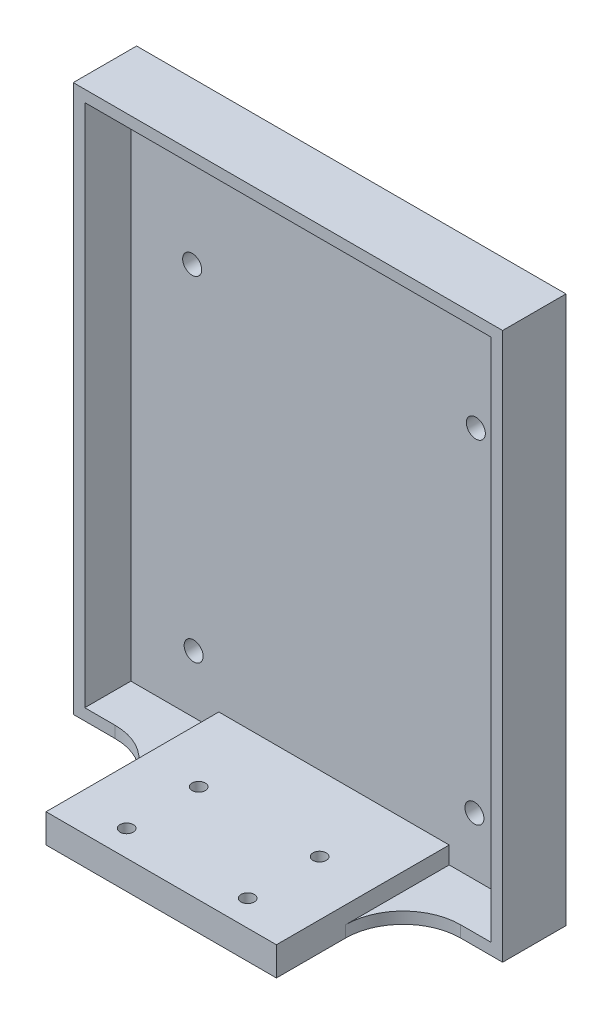
from build123d import *

# Parameters (mm, degrees)
CROQUIS1_W                  = 30
CROQUIS1_H                  = 30
SALIENTE_EXTRUIR1_DEPTH     = 15
CROQUIS6_R                  = 11.175
CORTAR_EXTRUIR1_DEPTH       = 10
CROQUIS11_W                 = 17.25
CROQUIS11_H                 = 40
SALIENTE_EXTRUIR3_DEPTH     = 12
CORTAR_EXTRUIR2_DEPTH       = 220.794464504
CORTAR_EXTRUIR2_DEPTH_BACK  = 220.794464504
CROQUIS9_R                  = 5
CROQUIS14_W                 = 64.5
CROQUIS14_H                 = 82
SALIENTE_EXTRUIR4_DEPTH     = 40
CORTAR_EXTRUIR3_START       = -10
CROQUIS10_R                 = 11.175
CORTAR_EXTRUIR3_DEPTH       = 10
CORTAR_EXTRUIR5_DEPTH       = 230.716361252
CORTAR_EXTRUIR5_DEPTH_BACK  = 10
CROQUIS13_R                 = 11.175
CORTAR_EXTRUIR6_DEPTH       = 183.220714139
CROQUIS16_W                 = 64.5
CROQUIS16_H                 = 82
CROQUIS16_W_2               = 56
CROQUIS16_H_2               = 77
SALIENTE_EXTRUIR5_DEPTH     = 5
CROQUIS17_W                 = 30
CROQUIS17_H                 = 30
CORTAR_EXTRUIR7_DEPTH       = 218.102899858
CROQUIS19_W                 = 18
CROQUIS19_H                 = 4.5
SALIENTE_EXTRUIR6_DEPTH     = 60
CROQUIS22_W                 = 12
CROQUIS22_H                 = 15
CORTAR_EXTRUIR8_DEPTH       = 2
CROQUIS23_W                 = 3.8
CROQUIS23_H                 = 47
SALIENTE_EXTRUIR8_DEPTH     = 19.8
CROQUIS24_R                 = 8.35
CROQUIS24_R_2               = 1
CROQUIS24_W                 = 4.8
CROQUIS24_H                 = 12
CORTAR_EXTRUIR10_DEPTH      = 241.553879883
CROQUIS25_W                 = 3.8
CROQUIS25_H                 = 47
SALIENTE_EXTRUIR9_DEPTH     = 2
REDONDEO2_R                 = 3
CROQUIS26_W                 = 47
CROQUIS26_H                 = 3.8
SALIENTE_EXTRUIR10_DEPTH    = 21.8
REDONDEO3_R                 = 3
CROQUIS28_R                 = 8.35
CROQUIS28_R_2               = 1
CROQUIS28_W                 = 12
CROQUIS28_H                 = 4.8
CORTAR_EXTRUIR11_DEPTH      = 21.8
CORTAR_EXTRUIR12_DEPTH      = 231.964513782
CORTAR_EXTRUIR12_DEPTH_BACK = 231.964513782
CORTAR_EXTRUIR13_DEPTH      = 218.102899858
CORTAR_EXTRUIR13_DEPTH_BACK = 218.102899858
CROQUIS29_R                 = 1.65
CORTAR_EXTRUIR14_DEPTH      = 221.700405815
CORTAR_EXTRUIR14_DEPTH_BACK = 8
CROQUIS32_R                 = 5.15
CROQUIS34_W                 = 22.273731586
CROQUIS34_H                 = 49.346142378
SALIENTE_EXTRUIR11_DEPTH    = 12
CORTAR_EXTRUIR17_DEPTH      = 233.924926242
CORTAR_EXTRUIR17_DEPTH_BACK = 233.924926242
CORTAR_EXTRUIR18_DEPTH      = 233.924926242
CORTAR_EXTRUIR18_DEPTH_BACK = 233.924926242
CORTAR_EXTRUIR19_DEPTH      = 225.26027095
CORTAR_EXTRUIR19_DEPTH_BACK = 225.26027095
CROQUIS38_R                 = 1.3
CORTAR_EXTRUIR20_START      = -8.5
CROQUIS39_W                 = 74.547463172
CROQUIS39_H                 = 11
CORTAR_EXTRUIR20_DEPTH      = 8.5
CROQUIS40_W                 = 17
CROQUIS40_H                 = 22
SALIENTE_EXTRUIR12_DEPTH    = 15
CROQUIS41_R                 = 1.3
CORTAR_EXTRUIR25_DEPTH      = 15
CROQUIS42_W                 = 12.6
CROQUIS42_H                 = 7
CORTAR_EXTRUIR26_DEPTH      = 7.1
CROQUIS43_W                 = 12.6
CROQUIS43_H                 = 10
CORTAR_EXTRUIR27_DEPTH      = 12.1
CORTAR_EXTRUIR28_DEPTH      = 218.102899858
CORTAR_EXTRUIR28_DEPTH_BACK = 218.102899858
CROQUIS44_W                 = 157.170171999
CROQUIS44_H                 = 272.215906008
CROQUIS44_W_2               = 74.547463172
CROQUIS44_H_2               = 95
CORTAR_EXTRUIR29_DEPTH      = 151.45827812
CORTAR_EXTRUIR29_DEPTH_BACK = 12
CROQUIS45_W                 = 74.547463172
CROQUIS45_H                 = 95
CROQUIS46_W                 = 40
CROQUIS46_H                 = 5
SALIENTE_EXTRUIR13_DEPTH    = 30
CROQUIS47_W                 = 74.547463172
CROQUIS47_H                 = 95
CROQUIS47_W_2               = 70.547463172
CROQUIS47_H_2               = 91
SALIENTE_EXTRUIR14_DEPTH    = 8
REDONDEO4_R                 = 10
CROQUIS49_R                 = 1.15
CORTAR_EXTRUIR30_DEPTH      = 8


with BuildPart() as part:
    # Croquis1 → Saliente-Extruir1 (new body)
    with BuildSketch(Plane.XY):
        with BuildLine():
            Line((-55.75, 30), (-32.25, 30))
            Line((-32.25, 30), (-32.25, -30))
            Line((-32.25, -30), (-55, -34.220247666))
            Line((-55, -34.220247666), (-55, -125.720247666))
            Line((-55, -125.720247666), (-37.273731586, -140.594352954))
            Line((-37.273731586, -140.594352954), (-37.273731586, -189.940495332))
            Line((-37.273731586, -189.940495332), (-55.75, -189.940495332))
            ThreePointArc((-55.75, -189.940495332), (-51.356645257, -200.54705351), (-40.750123148, -204.940495332))
            Line((-40.750123148, -204.940495332), (0, -204.940495332))
            Line((0, -204.940495332), (40.75, -204.940495332))
            ThreePointArc((40.75, -204.940495332), (51.356601718, -200.547097049), (55.75, -189.940495332))
            Line((55.75, -189.940495332), (37.273731586, -189.940495332))
            Line((37.273731586, -189.940495332), (37.273731586, -140.594352954))
            Line((37.273731586, -140.594352954), (55, -125.720247666))
            Line((55, -125.720247666), (55, -34.220247666))
            Line((55, -34.220247666), (32.25, -30))
            Line((32.25, -30), (32.25, 30))
            Line((32.25, 30), (55.75, 30))
            ThreePointArc((55.75, 30), (51.356601718, 40.606601718), (40.75, 45))
            Line((40.75, 45), (0, 45))
            Line((0, 45), (-40.750123148, 45))
            ThreePointArc((-40.750123148, 45), (-51.356645257, 40.606558178), (-55.75, 30))
        make_face()
        Rectangle(CROQUIS1_W, CROQUIS1_H, mode=Mode.SUBTRACT)
    extrude(amount=SALIENTE_EXTRUIR1_DEPTH)

    # Croquis6 → Cortar-Extruir1 (cut)
    with BuildSketch(Plane.ZY.offset(32.25)):
        with Locations((3, 0)):
            Circle(CROQUIS6_R)
    extrude(amount=-CORTAR_EXTRUIR1_DEPTH, mode=Mode.SUBTRACT)

    # Croquis11 → Saliente-Extruir3 (add)
    with BuildSketch(Plane(origin=(0, 0, 0), x_dir=(-1, 0, 0), z_dir=(0, 0, -1))):
        with Locations((23.625, 0)):
            Rectangle(CROQUIS11_W, CROQUIS11_H)
        with Locations((-23.625, 0)):
            Rectangle(CROQUIS11_W, CROQUIS11_H)
    extrude(amount=SALIENTE_EXTRUIR3_DEPTH)

    # Croquis9 → Cortar-Extruir2 (cut, two sides: drawn at the far end of the back side and taken through both)
    with BuildSketch(Plane.ZY.offset(22.25).offset(-CORTAR_EXTRUIR2_DEPTH_BACK)):
        with Locations(Location((3, 0, 0), (0, 0, 233.130102354))):
            Circle(CROQUIS9_R)
    extrude(amount=CORTAR_EXTRUIR2_DEPTH + CORTAR_EXTRUIR2_DEPTH_BACK, mode=Mode.SUBTRACT)

    # Croquis14 → Saliente-Extruir4 (add)
    with BuildSketch(Plane.XY.offset(15)):
        with Locations((0, 0.593167368)):
            Rectangle(CROQUIS14_W, CROQUIS14_H)
    extrude(amount=SALIENTE_EXTRUIR4_DEPTH)

    # Croquis10 → Cortar-Extruir3 (cut)
    with BuildSketch(Plane(origin=(32.25, 0, 0), x_dir=(0, 0, -1), z_dir=(1, 0, 0)).offset(CORTAR_EXTRUIR3_START)):
        with Locations((-3, 0)):
            Circle(CROQUIS10_R)
    extrude(amount=CORTAR_EXTRUIR3_DEPTH, mode=Mode.SUBTRACT)

    # Croquis13 → Cortar-Extruir5 (cut, two sides: drawn at the far end of the back side and taken through both)
    with BuildSketch(Plane.ZY.offset(32.25).offset(-CORTAR_EXTRUIR5_DEPTH_BACK)):
        with Locations((3, 0)):
            Circle(CROQUIS13_R)
    extrude(amount=CORTAR_EXTRUIR5_DEPTH + CORTAR_EXTRUIR5_DEPTH_BACK, mode=Mode.SUBTRACT)

    # Croquis15 → Cortar-Extruir6 (cut, through all)
    with BuildSketch(Plane.XZ.offset(40.406832632)):
        with BuildLine():
            Line((-22.25, 15), (-22.25, 35))
            ThreePointArc((-22.25, 35), (-19.321067812, 42.071067812), (-12.25, 45))
            Line((-12.25, 45), (12.25, 45))
            ThreePointArc((12.25, 45), (19.321067812, 42.071067812), (22.25, 35))
            Line((22.25, 35), (22.25, 15))
            Line((22.25, 15), (-22.25, 15))
        make_face()
    extrude(amount=-CORTAR_EXTRUIR6_DEPTH, mode=Mode.SUBTRACT)

    # Croquis16 → Saliente-Extruir5 (add)
    with BuildSketch(Plane.XY.offset(55)):
        with Locations((0, 0.593167368)):
            Rectangle(CROQUIS16_W, CROQUIS16_H)
        Rectangle(CROQUIS16_W_2, CROQUIS16_H_2, mode=Mode.SUBTRACT)
    extrude(amount=SALIENTE_EXTRUIR5_DEPTH)

    # Croquis17 → Cortar-Extruir7 (cut, through all)
    with BuildSketch(Plane.XY.offset(15)):
        with Locations((0, 30)):
            Rectangle(CROQUIS17_W, CROQUIS17_H)
    extrude(amount=-CORTAR_EXTRUIR7_DEPTH, mode=Mode.SUBTRACT)

    # Croquis19 → Saliente-Extruir6 (add)
    with BuildSketch(Plane(origin=(0, -15, 0), x_dir=(1, 0, 0), z_dir=(0, 1, 0))):
        with Locations((6, -12.75)):
            Rectangle(CROQUIS19_W, CROQUIS19_H)
    extrude(amount=SALIENTE_EXTRUIR6_DEPTH)

    # Croquis22 → Cortar-Extruir8 (cut)
    with BuildSketch(Plane(origin=(0, -15, 0), x_dir=(1, 0, 0), z_dir=(0, 1, 0))):
        with Locations((-9, -7.5)):
            Rectangle(CROQUIS22_W, CROQUIS22_H)
    extrude(amount=-CORTAR_EXTRUIR8_DEPTH, mode=Mode.SUBTRACT)

    # Croquis23 → Saliente-Extruir8 (add)
    with BuildSketch(Plane.XY.offset(15)):
        with Locations((53.1, -79.970247666)):
            Rectangle(CROQUIS23_W, CROQUIS23_H)
        with Locations((-53.1, -79.970247666)):
            Rectangle(CROQUIS23_W, CROQUIS23_H)
    extrude(amount=SALIENTE_EXTRUIR8_DEPTH)

    # Croquis24 → Cortar-Extruir10 (cut, through all)
    with BuildSketch(Plane(origin=(55, 0, 0), x_dir=(0, 0, -1), z_dir=(1, 0, 0))):
        with Locations((-25.3, -66.970247666)):
            Circle(CROQUIS24_R)
        with Locations((-25.3, -92.970247666)):
            Circle(CROQUIS24_R)
        with Locations((-16.3, -101.270247666)):
            Circle(CROQUIS24_R_2)
        with Locations((-33.7, -58.370247666)):
            Circle(CROQUIS24_R_2)
        with Locations((-16.1, -58.370247666)):
            Circle(CROQUIS24_R_2)
        with Locations((-33.5, -101.270247666)):
            Circle(CROQUIS24_R_2)
        with Locations((-17.7, -79.970247666)):
            Rectangle(CROQUIS24_W, CROQUIS24_H)
    extrude(amount=-CORTAR_EXTRUIR10_DEPTH, mode=Mode.SUBTRACT)

    # Croquis25 → Saliente-Extruir9 (add)
    with BuildSketch(Plane.XY.offset(34.8)):
        with Locations((-53.1, -79.970247666)):
            Rectangle(CROQUIS25_W, CROQUIS25_H)
        with Locations((53.1, -79.970247666)):
            Rectangle(CROQUIS25_W, CROQUIS25_H)
    extrude(amount=SALIENTE_EXTRUIR9_DEPTH)

    # Redondeo2
    redondeo2_edges = [part.edges().sort_by_distance(p)[0] for p in [
        (-53.1, -103.470247666, 36.8),
        (-53.1, -56.470247666, 36.8),
        (53.1, -103.470247666, 36.8),
        (53.1, -56.470247666, 36.8),
    ]]
    fillet(redondeo2_edges, radius=REDONDEO2_R)

    # Croquis26 → Saliente-Extruir10 (add)
    with BuildSketch(Plane.XY.offset(15)):
        with Locations((-6.1574e-05, -203.040495332)):
            Rectangle(CROQUIS26_W, CROQUIS26_H)
    extrude(amount=SALIENTE_EXTRUIR10_DEPTH)

    # Redondeo3
    redondeo3_edges = [part.edges().sort_by_distance(p)[0] for p in [
        (-23.500061574, -203.040495332, 36.8),
        (23.499938426, -203.040495332, 36.8),
    ]]
    fillet(redondeo3_edges, radius=REDONDEO3_R)

    # Croquis28 → Cortar-Extruir11 (cut)
    with BuildSketch(Plane.XZ.offset(204.940495332)):
        with Locations(Location((-13, 25.3, 0), (0, 0, 270))):
            Circle(CROQUIS28_R)
        with Locations(Location((13, 25.3, 0), (0, 0, 270))):
            Circle(CROQUIS28_R)
        with Locations(Location((-21.300061574, 16.3, 0), (0, 0, 270))):
            Circle(CROQUIS28_R_2)
        with Locations(Location((21.599938426, 33.7, 0), (0, 0, 270))):
            Circle(CROQUIS28_R_2)
        with Locations(Location((21.300061574, 16.3, 0), (0, 0, 270))):
            Circle(CROQUIS28_R_2)
        with Locations(Location((-21.599938426, 33.7, 0), (0, 0, 270))):
            Circle(CROQUIS28_R_2)
        with Locations((0, 17.7)):
            Rectangle(CROQUIS28_W, CROQUIS28_H)
    extrude(amount=-CORTAR_EXTRUIR11_DEPTH, mode=Mode.SUBTRACT)

    # Croquis12 → Cortar-Extruir12 (cut, two sides: drawn at the far end of the back side and taken through both)
    with BuildSketch(Plane(origin=(32.25, 0, 0), x_dir=(0, 0, -1), z_dir=(1, 0, 0)).offset(-CORTAR_EXTRUIR12_DEPTH_BACK)):
        with BuildLine():
            Line((0, 20), (12, 20))
            Line((12, 20), (12, 5))
            ThreePointArc((12, 5), (8.630857945, 14.604686356), (0, 20))
        make_face()
        with BuildLine():
            Line((12, -20), (12, -5))
            ThreePointArc((12, -5), (8.630857945, -14.604686356), (0, -20))
            Line((0, -20), (12, -20))
        make_face()
    extrude(amount=CORTAR_EXTRUIR12_DEPTH + CORTAR_EXTRUIR12_DEPTH_BACK, mode=Mode.SUBTRACT)

    # Croquis29 → Cortar-Extruir13 (cut, two sides: drawn at the far end of the back side and taken through both)
    with BuildSketch(Plane.XY.offset(15).offset(-CORTAR_EXTRUIR13_DEPTH_BACK)):
        with Locations(Location((-24.373731586, -132.994352954, 0), (0, 0, 180))):
            Circle(CROQUIS29_R)
        with Locations(Location((24.626268414, -74.994352954, 0), (0, 0, 180))):
            Circle(CROQUIS29_R)
        with Locations(Location((-24.626268414, -74.994352954, 0), (0, 0, 180))):
            Circle(CROQUIS29_R)
        with Locations(Location((24.373731586, -132.994352954, 0), (0, 0, 180))):
            Circle(CROQUIS29_R)
    extrude(amount=CORTAR_EXTRUIR13_DEPTH + CORTAR_EXTRUIR13_DEPTH_BACK, mode=Mode.SUBTRACT)

    # Croquis32 → Cortar-Extruir14 (cut, two sides: drawn at the far end of the back side and taken through both)
    with BuildSketch(Plane(origin=(0, 0, 0), x_dir=(-1, 0, 0), z_dir=(0, 0, -1)).offset(-CORTAR_EXTRUIR14_DEPTH_BACK)):
        with Locations(Location((-24.626268414, -74.994352954, 0), (0, 0, 180))):
            Circle(CROQUIS32_R)
        with Locations(Location((-24.373731586, -132.994352954, 0), (0, 0, 180))):
            Circle(CROQUIS32_R)
        with Locations(Location((24.373731586, -132.994352954, 0), (0, 0, 180))):
            Circle(CROQUIS32_R)
        with Locations(Location((24.626268414, -74.994352954, 0), (0, 0, 180))):
            Circle(CROQUIS32_R)
    extrude(amount=CORTAR_EXTRUIR14_DEPTH + CORTAR_EXTRUIR14_DEPTH_BACK, mode=Mode.SUBTRACT)

    # Croquis34 → Saliente-Extruir11 (add)
    with BuildSketch(Plane(origin=(0, 0, 0), x_dir=(-1, 0, 0), z_dir=(0, 0, -1))):
        with Locations((-26.136865793, -165.267424143)):
            Rectangle(CROQUIS34_W, CROQUIS34_H)
        with Locations((26.136865793, -165.267424143)):
            Rectangle(CROQUIS34_W, CROQUIS34_H)
    extrude(amount=SALIENTE_EXTRUIR11_DEPTH)

    # Croquis35 → Cortar-Extruir17 (cut, two sides: drawn at the far end of the back side and taken through both)
    with BuildSketch(Plane(origin=(37.273731586, 0, 0), x_dir=(0, 0, -1), z_dir=(1, 0, 0)).offset(-CORTAR_EXTRUIR17_DEPTH_BACK)):
        with BuildLine():
            Line((0, -140.594352954), (12, -140.594352954))
            Line((12, -140.594352954), (12, -148.594352954))
            ThreePointArc((12, -148.594352954), (6.568730644, -143.741256988), (0, -140.594352954))
        make_face()
        with BuildLine():
            Line((0, -189.940495332), (12, -189.940495332))
            Line((12, -189.940495332), (12, -181.940495332))
            ThreePointArc((12, -181.940495332), (6.568730644, -186.793591298), (0, -189.940495332))
        make_face()
    extrude(amount=CORTAR_EXTRUIR17_DEPTH + CORTAR_EXTRUIR17_DEPTH_BACK, mode=Mode.SUBTRACT)

    # Croquis37 → Cortar-Extruir18 (cut, two sides: drawn at the far end of the back side and taken through both)
    with BuildSketch(Plane.ZY.offset(37.273731586).offset(-CORTAR_EXTRUIR18_DEPTH_BACK)):
        with BuildLine():
            Line((-4.5, -155.267424143), (10.5, -155.267424143))
            Line((10.5, -155.267424143), (10.5, -181.267424143))
            ThreePointArc((10.5, -181.267424143), (9.328427125, -184.095851268), (6.5, -185.267424143))
            Line((6.5, -185.267424143), (-0.5, -185.267424143))
            ThreePointArc((-0.5, -185.267424143), (-3.328427125, -184.095851268), (-4.5, -181.267424143))
            Line((-4.5, -181.267424143), (-4.5, -155.267424143))
        make_face()
    extrude(amount=CORTAR_EXTRUIR18_DEPTH + CORTAR_EXTRUIR18_DEPTH_BACK, mode=Mode.SUBTRACT)

    # Croquis38 → Cortar-Extruir19 (cut, two sides: drawn at the far end of the back side and taken through both)
    with BuildSketch(Plane(origin=(0, 0, -12), x_dir=(-1, 0, 0), z_dir=(0, 0, -1)).offset(-CORTAR_EXTRUIR19_DEPTH_BACK)):
        with Locations((-26.136865793, -165.267424143)):
            Circle(CROQUIS38_R)
        with Locations((26.136865793, -165.267424143)):
            Circle(CROQUIS38_R)
    extrude(amount=CORTAR_EXTRUIR19_DEPTH + CORTAR_EXTRUIR19_DEPTH_BACK, mode=Mode.SUBTRACT)

    # Croquis39 → Cortar-Extruir20 (cut)
    with BuildSketch(Plane.XY.offset(15).offset(CORTAR_EXTRUIR20_START)):
        with Locations((0, -179.767424143)):
            Rectangle(CROQUIS39_W, CROQUIS39_H)
    extrude(amount=CORTAR_EXTRUIR20_DEPTH, mode=Mode.SUBTRACT)

    # Croquis40 → Saliente-Extruir12 (add)
    with BuildSketch(Plane.XY.offset(15)):
        with Locations((0, -163.267424143)):
            Rectangle(CROQUIS40_W, CROQUIS40_H)
    extrude(amount=SALIENTE_EXTRUIR12_DEPTH)

    # Croquis41 → Cortar-Extruir25 (cut)
    with BuildSketch(Plane.XY.offset(30)):
        with Locations((0, -153.767424143)):
            Circle(CROQUIS41_R)
    extrude(amount=-CORTAR_EXTRUIR25_DEPTH, mode=Mode.SUBTRACT)

    # Croquis42 → Cortar-Extruir26 (cut)
    with BuildSketch(Plane.XY.offset(30)):
        with Locations((0, -160.767424143)):
            Rectangle(CROQUIS42_W, CROQUIS42_H)
    extrude(amount=-CORTAR_EXTRUIR26_DEPTH, mode=Mode.SUBTRACT)

    # Croquis43 → Cortar-Extruir27 (cut)
    with BuildSketch(Plane.XY.offset(30)):
        with Locations((0, -169.267424143)):
            Rectangle(CROQUIS43_W, CROQUIS43_H)
    extrude(amount=-CORTAR_EXTRUIR27_DEPTH, mode=Mode.SUBTRACT)

    # Croquis44 → Cortar-Extruir28 (cut, two sides: drawn at the far end of the back side and taken through both)
    with BuildSketch(Plane.XY.offset(15).offset(-CORTAR_EXTRUIR28_DEPTH_BACK)):
        with Locations((3.185881864, -79.262273918)):
            Rectangle(CROQUIS44_W, CROQUIS44_H)
        with Locations((0, -97.494352954)):
            Rectangle(CROQUIS44_W_2, CROQUIS44_H_2, mode=Mode.SUBTRACT)
    extrude(amount=CORTAR_EXTRUIR28_DEPTH + CORTAR_EXTRUIR28_DEPTH_BACK, mode=Mode.SUBTRACT)

    # Croquis45 → Cortar-Extruir29 (cut, two sides: drawn at the far end of the back side and taken through both)
    with BuildSketch(Plane(origin=(0, 0, 0), x_dir=(-1, 0, 0), z_dir=(0, 0, -1)).offset(-CORTAR_EXTRUIR29_DEPTH_BACK)):
        with Locations((0, -97.494352954)):
            Rectangle(CROQUIS45_W, CROQUIS45_H)
    extrude(amount=CORTAR_EXTRUIR29_DEPTH + CORTAR_EXTRUIR29_DEPTH_BACK, mode=Mode.SUBTRACT)

    # Croquis46 → Saliente-Extruir13 (add)
    with BuildSketch(Plane.XY.offset(15)):
        with Locations((0, -142.494352954)):
            Rectangle(CROQUIS46_W, CROQUIS46_H)
    extrude(amount=SALIENTE_EXTRUIR13_DEPTH)

    # Croquis47 → Saliente-Extruir14 (add)
    with BuildSketch(Plane.XY.offset(15)):
        with Locations((0, -97.494352954)):
            Rectangle(CROQUIS47_W, CROQUIS47_H)
        with Locations((0, -97.494352954)):
            Rectangle(CROQUIS47_W_2, CROQUIS47_H_2, mode=Mode.SUBTRACT)
    extrude(amount=SALIENTE_EXTRUIR14_DEPTH)

    # Redondeo4
    redondeo4_edges = [part.edges().sort_by_distance(p)[0] for p in [
        (20, -143.994352954, 23),
        (-20, -143.994352954, 23),
    ]]
    fillet(redondeo4_edges, radius=REDONDEO4_R)

    # Croquis49 → Cortar-Extruir30 (cut)
    with BuildSketch(Plane.XZ.offset(144.994352954)):
        with Locations(Location((-10.5, 40.5, 0), (0, 0, 270))):
            Circle(CROQUIS49_R)
        with Locations(Location((10.5, 40.5, 0), (0, 0, 270))):
            Circle(CROQUIS49_R)
        with Locations(Location((-10.5, 28, 0), (0, 0, 270))):
            Circle(CROQUIS49_R)
        with Locations(Location((10.5, 28, 0), (0, 0, 270))):
            Circle(CROQUIS49_R)
    extrude(amount=-CORTAR_EXTRUIR30_DEPTH, mode=Mode.SUBTRACT)


solid = part.part
